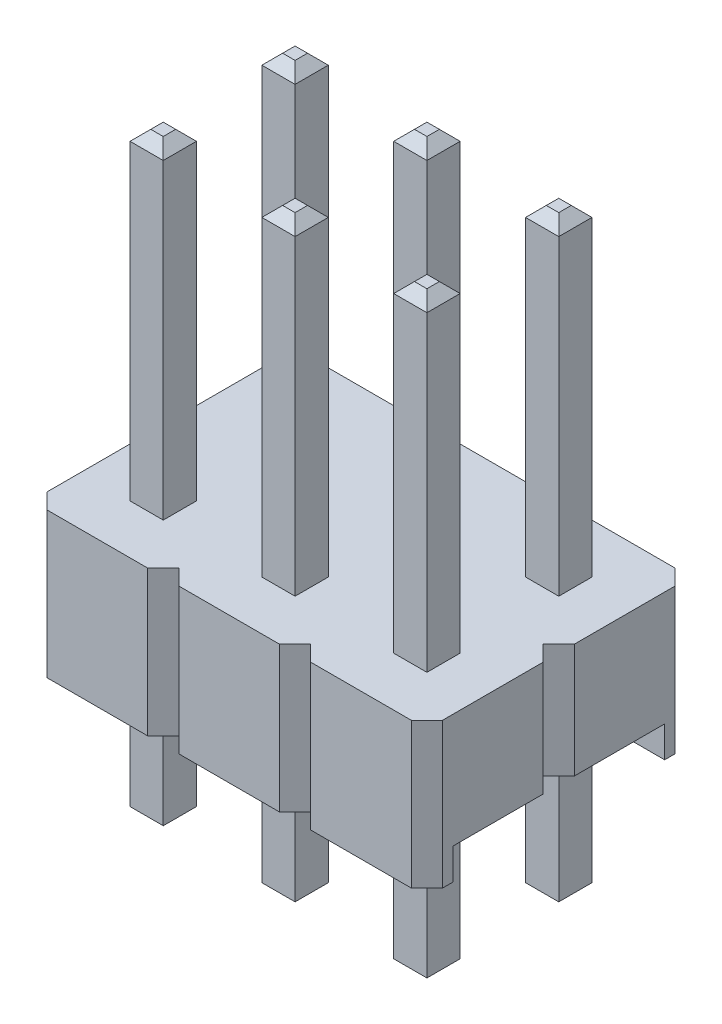
from build123d import *

# Parameters (mm, degrees)
SKETCH1_W                  = 0.64
SKETCH1_H                  = 0.64
BOSS_EXTRUDE1_DEPTH        = 2.8
CUT_EXTRUDE1_DEPTH         = 6.367280503
CUT_EXTRUDE1_DEPTH_BACK    = 6.367280503
SKETCH2_W                  = 4.08
SKETCH2_H                  = 0.6
BOSS_EXTRUDE2_DEPTH        = 9
BOSS_EXTRUDE2_DEPTH_BACK   = 2.5
SKETCH1_2_W                = 0.64
SKETCH1_2_H                = 0.64
BOSS_EXTRUDE2_2_DEPTH      = 9
BOSS_EXTRUDE2_2_DEPTH_BACK = 2.5
BOSS_EXTRUDE2_3_DEPTH      = 9
BOSS_EXTRUDE2_3_DEPTH_BACK = 2.5
BOSS_EXTRUDE2_4_DEPTH      = 9
BOSS_EXTRUDE2_4_DEPTH_BACK = 2.5
BOSS_EXTRUDE2_5_DEPTH      = 9
BOSS_EXTRUDE2_5_DEPTH_BACK = 2.5
BOSS_EXTRUDE2_6_DEPTH      = 9
BOSS_EXTRUDE2_6_DEPTH_BACK = 2.5
CHAMFER1_SIZE              = 0.2
CHAMFER2_SIZE              = 0.2
CHAMFER3_SIZE              = 0.2
CHAMFER4_SIZE              = 0.2
CHAMFER5_SIZE              = 0.2
CHAMFER6_SIZE              = 0.2


with BuildPart() as part:
    # Sketch1 → Boss-Extrude1 (new body)
    with BuildSketch(Plane(origin=(0, 0, 0), x_dir=(1, 0, 0), z_dir=(0, 1, 0))):
        Polygon((-3.81, 2.24), (-3.51, 2.54), (-1.57, 2.54), (-1.27, 2.24), (-0.97, 2.54), (0.97, 2.54), (1.27, 2.24), (1.57, 2.54), (3.51, 2.54), (3.81, 2.24), (3.81, 0.3), (3.51, 0), (3.81, -0.3), (3.81, -2.24), (3.51, -2.54), (1.57, -2.54), (1.27, -2.24), (0.97, -2.54), (-0.97, -2.54), (-1.27, -2.24), (-1.57, -2.54), (-3.51, -2.54), (-3.81, -2.24), (-3.81, -0.3), (-3.51, 0), (-3.81, 0.3), align=None)
        with Locations((-2.54, 1.27)):
            Rectangle(SKETCH1_W, SKETCH1_H, mode=Mode.SUBTRACT)
        with Locations((0, 1.27)):
            Rectangle(SKETCH1_W, SKETCH1_H, mode=Mode.SUBTRACT)
        with Locations((2.54, 1.27)):
            Rectangle(SKETCH1_W, SKETCH1_H, mode=Mode.SUBTRACT)
        with Locations((0, -1.27)):
            Rectangle(SKETCH1_W, SKETCH1_H, mode=Mode.SUBTRACT)
        with Locations((2.54, -1.27)):
            Rectangle(SKETCH1_W, SKETCH1_H, mode=Mode.SUBTRACT)
        with Locations((-2.54, -1.27)):
            Rectangle(SKETCH1_W, SKETCH1_H, mode=Mode.SUBTRACT)
    extrude(amount=BOSS_EXTRUDE1_DEPTH)

    # Sketch2 → Cut-Extrude1 (cut, two sides: drawn at the far end of the back side and taken through both)
    with BuildSketch(Plane(origin=(0, 0, 0), x_dir=(0, 0, -1), z_dir=(1, 0, 0)).offset(-CUT_EXTRUDE1_DEPTH_BACK)):
        with Locations((0, 0.3)):
            Rectangle(SKETCH2_W, SKETCH2_H)
    extrude(amount=CUT_EXTRUDE1_DEPTH + CUT_EXTRUDE1_DEPTH_BACK, mode=Mode.SUBTRACT)


with BuildPart() as body_2:
    # Sketch1<2> → Boss-Extrude2 (new, two sides: drawn at the far end of the back side and taken through both)
    with BuildSketch(Plane(origin=(0, 0, 0), x_dir=(1, 0, 0), z_dir=(0, 1, 0)).offset(-BOSS_EXTRUDE2_DEPTH_BACK)):
        with Locations((-2.54, 1.27)):
            Rectangle(SKETCH1_2_W, SKETCH1_2_H)
    extrude(amount=BOSS_EXTRUDE2_DEPTH + BOSS_EXTRUDE2_DEPTH_BACK)

    # Chamfer1
    chamfer1_edges = [body_2.edges().sort_by_distance(p)[0] for p in [
        (-2.54, -2.5, -0.95),
        (-2.22, -2.5, -1.27),
        (-2.54, -2.5, -1.59),
        (-2.86, -2.5, -1.27),
        (-2.54, 9, -1.59),
        (-2.22, 9, -1.27),
        (-2.54, 9, -0.95),
        (-2.86, 9, -1.27),
    ]]
    chamfer(chamfer1_edges, length=CHAMFER1_SIZE)


with BuildPart() as body_3:
    # Sketch1<2> → Boss-Extrude2 2 (new, two sides: drawn at the far end of the back side and taken through both)
    with BuildSketch(Plane(origin=(0, 0, 0), x_dir=(1, 0, 0), z_dir=(0, 1, 0)).offset(-BOSS_EXTRUDE2_2_DEPTH_BACK)):
        with Locations((0, 1.27)):
            Rectangle(SKETCH1_2_W, SKETCH1_2_H)
    extrude(amount=BOSS_EXTRUDE2_2_DEPTH + BOSS_EXTRUDE2_2_DEPTH_BACK)

    # Chamfer4
    chamfer4_edges = [body_3.edges().sort_by_distance(p)[0] for p in [
        (0, 9, -1.59),
        (0.32, 9, -1.27),
        (0, 9, -0.95),
        (-0.32, 9, -1.27),
        (0, -2.5, -0.95),
        (0.32, -2.5, -1.27),
        (0, -2.5, -1.59),
        (-0.32, -2.5, -1.27),
    ]]
    chamfer(chamfer4_edges, length=CHAMFER4_SIZE)


with BuildPart() as body_4:
    # Sketch1<2> → Boss-Extrude2 3 (new, two sides: drawn at the far end of the back side and taken through both)
    with BuildSketch(Plane(origin=(0, 0, 0), x_dir=(1, 0, 0), z_dir=(0, 1, 0)).offset(-BOSS_EXTRUDE2_3_DEPTH_BACK)):
        with Locations((2.54, 1.27)):
            Rectangle(SKETCH1_2_W, SKETCH1_2_H)
    extrude(amount=BOSS_EXTRUDE2_3_DEPTH + BOSS_EXTRUDE2_3_DEPTH_BACK)

    # Chamfer6
    chamfer6_edges = [body_4.edges().sort_by_distance(p)[0] for p in [
        (2.54, -2.5, -0.95),
        (2.86, -2.5, -1.27),
        (2.54, -2.5, -1.59),
        (2.22, -2.5, -1.27),
        (2.54, 9, -1.59),
        (2.86, 9, -1.27),
        (2.54, 9, -0.95),
        (2.22, 9, -1.27),
    ]]
    chamfer(chamfer6_edges, length=CHAMFER6_SIZE)


with BuildPart() as body_5:
    # Sketch1<2> → Boss-Extrude2 4 (new, two sides: drawn at the far end of the back side and taken through both)
    with BuildSketch(Plane(origin=(0, 0, 0), x_dir=(1, 0, 0), z_dir=(0, 1, 0)).offset(-BOSS_EXTRUDE2_4_DEPTH_BACK)):
        with Locations((0, -1.27)):
            Rectangle(SKETCH1_2_W, SKETCH1_2_H)
    extrude(amount=BOSS_EXTRUDE2_4_DEPTH + BOSS_EXTRUDE2_4_DEPTH_BACK)

    # Chamfer3
    chamfer3_edges = [body_5.edges().sort_by_distance(p)[0] for p in [
        (0, -2.5, 1.59),
        (0.32, -2.5, 1.27),
        (0, -2.5, 0.95),
        (-0.32, -2.5, 1.27),
        (0, 9, 0.95),
        (0.32, 9, 1.27),
        (0, 9, 1.59),
        (-0.32, 9, 1.27),
    ]]
    chamfer(chamfer3_edges, length=CHAMFER3_SIZE)


with BuildPart() as body_6:
    # Sketch1<2> → Boss-Extrude2 5 (new, two sides: drawn at the far end of the back side and taken through both)
    with BuildSketch(Plane(origin=(0, 0, 0), x_dir=(1, 0, 0), z_dir=(0, 1, 0)).offset(-BOSS_EXTRUDE2_5_DEPTH_BACK)):
        with Locations((2.54, -1.27)):
            Rectangle(SKETCH1_2_W, SKETCH1_2_H)
    extrude(amount=BOSS_EXTRUDE2_5_DEPTH + BOSS_EXTRUDE2_5_DEPTH_BACK)

    # Chamfer5
    chamfer5_edges = [body_6.edges().sort_by_distance(p)[0] for p in [
        (2.54, 9, 0.95),
        (2.86, 9, 1.27),
        (2.54, 9, 1.59),
        (2.22, 9, 1.27),
        (2.54, -2.5, 1.59),
        (2.86, -2.5, 1.27),
        (2.54, -2.5, 0.95),
        (2.22, -2.5, 1.27),
    ]]
    chamfer(chamfer5_edges, length=CHAMFER5_SIZE)


with BuildPart() as body_7:
    # Sketch1<2> → Boss-Extrude2 6 (new, two sides: drawn at the far end of the back side and taken through both)
    with BuildSketch(Plane(origin=(0, 0, 0), x_dir=(1, 0, 0), z_dir=(0, 1, 0)).offset(-BOSS_EXTRUDE2_6_DEPTH_BACK)):
        with Locations((-2.54, -1.27)):
            Rectangle(SKETCH1_2_W, SKETCH1_2_H)
    extrude(amount=BOSS_EXTRUDE2_6_DEPTH + BOSS_EXTRUDE2_6_DEPTH_BACK)

    # Chamfer2
    chamfer2_edges = [body_7.edges().sort_by_distance(p)[0] for p in [
        (-2.54, -2.5, 1.59),
        (-2.22, -2.5, 1.27),
        (-2.54, -2.5, 0.95),
        (-2.86, -2.5, 1.27),
        (-2.54, 9, 0.95),
        (-2.22, 9, 1.27),
        (-2.54, 9, 1.59),
        (-2.86, 9, 1.27),
    ]]
    chamfer(chamfer2_edges, length=CHAMFER2_SIZE)


solid = Compound([part.part, body_2.part, body_3.part, body_4.part, body_5.part, body_6.part, body_7.part])
